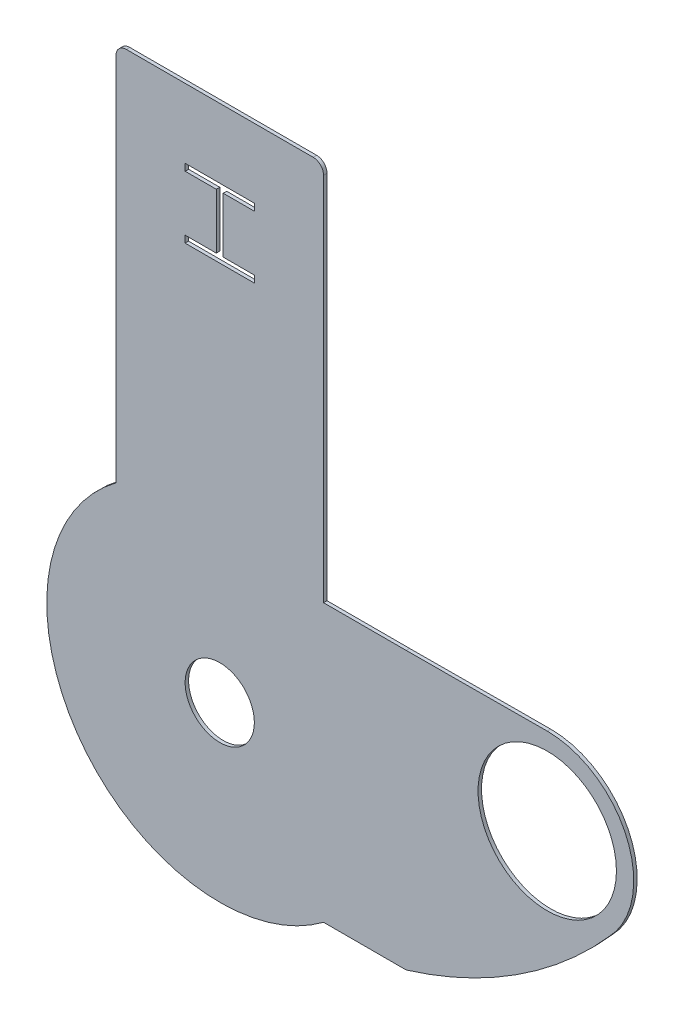
from build123d import *

# Parameters (mm, degrees)
SKETCH1_R           = 10
BOSS_EXTRUDE1_DEPTH = 1
SKETCH2_R           = 10
CUT_EXTRUDE1_DEPTH  = 1
SKETCH3_R           = 20
CUT_EXTRUDE2_DEPTH  = 1
CUT_EXTRUDE3_DEPTH  = 127.23292637
BOSS_EXTRUDE2_DEPTH = 1
BOSS_EXTRUDE4_DEPTH = 1


with BuildPart() as part:
    # Sketch1 → Boss-Extrude1 (new body)
    with BuildSketch(Plane.XY):
        with BuildLine():
            Line((94.42701916, 40.188914375), (53.885, 40))
            Line((53.885, 40), (-53.885, 40))
            Line((-53.885, 40), (-53.885, -40))
            Line((-53.885, -40), (53.885, -40))
            ThreePointArc((53.885, -40), (85.857258243, -25.182373866), (112.594107484, -2.227456438))
            ThreePointArc((112.594107484, -2.227456438), (117.686467499, 24.925594205), (94.66, 40.19))
            Line((94.66, 40.19), (94.42701916, 40.188914375))
        make_face()
        with Locations((91.76, 19.26)):
            Circle(SKETCH1_R, mode=Mode.SUBTRACT)
    extrude(amount=BOSS_EXTRUDE1_DEPTH)

    # Sketch2 → Cut-Extrude1 (cut)
    with BuildSketch(Plane.XY.offset(1)):
        Circle(SKETCH2_R)
    extrude(amount=-CUT_EXTRUDE1_DEPTH, mode=Mode.SUBTRACT)

    # Sketch3 → Cut-Extrude2 (cut)
    with BuildSketch(Plane.XY.offset(1)):
        with Locations((94.66, 15.19)):
            Circle(SKETCH3_R)
    extrude(amount=-CUT_EXTRUDE2_DEPTH, mode=Mode.SUBTRACT)

    # Sketch4 → Cut-Extrude3 (cut, through all)
    with BuildSketch(Plane.XY.offset(1)):
        with BuildLine():
            Line((-53.885, 40), (-30, 40))
            ThreePointArc((-30, 40), (-50, 0), (-30, -40))
            Line((-30, -40), (-53.885, -40))
            Line((-53.885, -40), (-53.885, 40))
        make_face()
    extrude(amount=-CUT_EXTRUDE3_DEPTH, mode=Mode.SUBTRACT)

    # Sketch5 → Boss-Extrude2 (add)
    with BuildSketch(Plane.XY.offset(1)):
        with BuildLine():
            Line((-30, -40), (30, -40))
            ThreePointArc((30, -40), (0, -50), (-30, -40))
        make_face()
    extrude(amount=-BOSS_EXTRUDE2_DEPTH)

    # Sketch6 → Boss-Extrude4 (add)
    with BuildSketch(Plane.XY.offset(1)):
        with BuildLine():
            Line((-30, 40), (-30, 147))
            ThreePointArc((-30, 147), (-29.121320344, 149.121320344), (-27, 150))
            Line((-27, 150), (27, 150))
            ThreePointArc((27, 150), (29.121320344, 149.121320344), (30, 147))
            Line((30, 147), (30, 40))
            Line((30, 40), (-30, 40))
        make_face()
        Polygon((-1, 128), (-1, 112), (-10, 112), (-10, 110), (10, 110), (10, 112), (1, 112), (1, 128), (10, 128), (10, 130), (-10, 130), (-10, 128), align=None, mode=Mode.SUBTRACT)
    extrude(amount=-BOSS_EXTRUDE4_DEPTH)


solid = part.part
